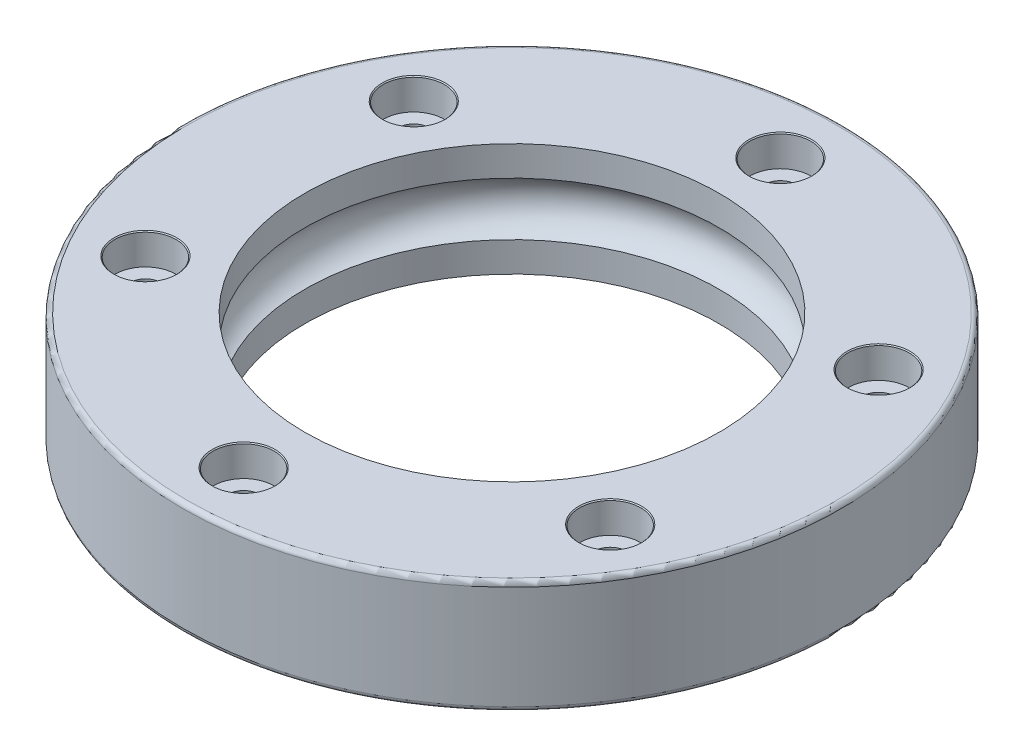
from build123d import *

# Parameters (mm, degrees)
FILLET_1_R          = 0.5
SKETCH_2_R          = 1.7
CUT_EXTRUDE_1_DEPTH = 20
SKETCH_3_R          = 3.25
CUT_EXTRUDE_2_DEPTH = 3.3
CHAMFER_1_SIZE      = 0.1


with BuildPart() as part:
    # 草图1 → 旋转1 (revolve)
    with BuildSketch(Plane.XY, mode=Mode.PRIVATE) as revolve_1_sk:
        with BuildLine():
            Line((-22, 6), (-22, 2.828427125))
            ThreePointArc((-22, 2.828427125), (-24, 0), (-22, -2.828427125))
            Line((-22, -2.828427125), (-22, -6))
            Line((-22, -6), (-35, -6))
            Line((-35, -6), (-35, 6))
            Line((-35, 6), (-22, 6))
        make_face()
    revolve(revolve_1_sk.sketch.rotate(Axis((0, 15.876951414, 0), (0, -1, 0)), 270), axis=Axis((0, 15.876951414, 0), (0, -1, 0)))

    # 圆角1
    fillet_1_edges = [part.edges().sort_by_distance(p)[0] for p in [
        (0, -6, -35),
        (0, 6, -35),
    ]]
    fillet(fillet_1_edges, radius=FILLET_1_R)

    # 草图2 → 切除-拉伸1 (cut)
    with BuildSketch(Plane(origin=(0, 6, 0), x_dir=(1, 0, 0), z_dir=(0, 1, 0))):
        with Locations(Location((0, 28.5, 0), (0, 0, 270))):
            Circle(SKETCH_2_R)
        with Locations(Location((24.681724008, 14.25, 0), (0, 0, 270))):
            Circle(SKETCH_2_R)
        with Locations(Location((24.681724008, -14.25, 0), (0, 0, 270))):
            Circle(SKETCH_2_R)
        with Locations(Location((0, -28.5, 0), (0, 0, 270))):
            Circle(SKETCH_2_R)
        with Locations(Location((-24.681724008, -14.25, 0), (0, 0, 270))):
            Circle(SKETCH_2_R)
        with Locations(Location((-24.681724008, 14.25, 0), (0, 0, 270))):
            Circle(SKETCH_2_R)
    extrude(amount=-CUT_EXTRUDE_1_DEPTH, mode=Mode.SUBTRACT)

    # 草图3 → 切除-拉伸2 (cut)
    with BuildSketch(Plane(origin=(0, 6, 0), x_dir=(1, 0, 0), z_dir=(0, 1, 0))):
        with Locations(Location((0, 28.5, 0), (0, 0, 270))):
            Circle(SKETCH_3_R)
        with Locations(Location((24.681724008, 14.25, 0), (0, 0, 270))):
            Circle(SKETCH_3_R)
        with Locations(Location((24.681724008, -14.25, 0), (0, 0, 270))):
            Circle(SKETCH_3_R)
        with Locations(Location((0, -28.5, 0), (0, 0, 270))):
            Circle(SKETCH_3_R)
        with Locations(Location((-24.681724008, -14.25, 0), (0, 0, 270))):
            Circle(SKETCH_3_R)
        with Locations(Location((-24.681724008, 14.25, 0), (0, 0, 270))):
            Circle(SKETCH_3_R)
    extrude(amount=-CUT_EXTRUDE_2_DEPTH, mode=Mode.SUBTRACT)

    # 倒角1
    chamfer_1_edges = [part.edges().sort_by_distance(p)[0] for p in [
        (0, 6, -31.75),
        (24.681724008, 6, -17.5),
        (24.681724008, 6, 11),
        (0, 6, 25.25),
        (-24.681724008, 6, 11),
        (-24.681724008, 6, -17.5),
    ]]
    chamfer(chamfer_1_edges, length=CHAMFER_1_SIZE)


solid = part.part
